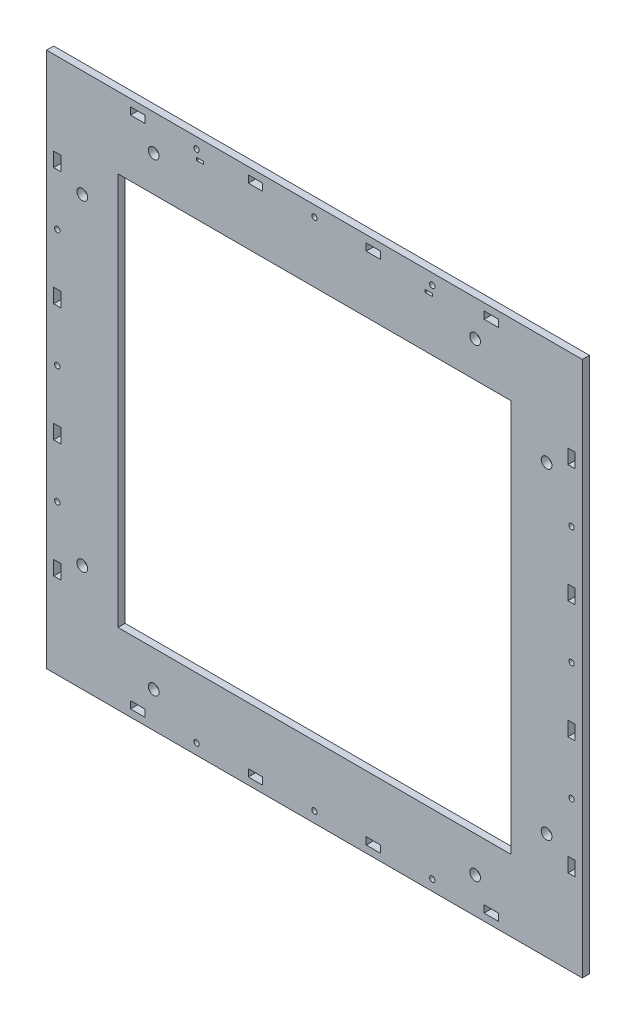
from build123d import *

# Parameters (mm, degrees)
SKETCH_1_R          = 21.5
SKETCH_1_R_2        = 2.1
SKETCH_1_W          = 4
SKETCH_1_H          = 1.5
EXTRUDE_1_DEPTH     = 4
SKETCH_3_R          = 1.5
SKETCH_3_R_2        = 1.65
SKETCH_3_W          = 8.03
SKETCH_3_H          = 4.03
SKETCH_3_W_2        = 4.03
SKETCH_3_H_2        = 8.03
CUT_EXTRUDE_2_DEPTH = 4
SKETCH_7_R          = 3
CUT_EXTRUDE_3_DEPTH = 10
SKETCH_8_W          = 220
SKETCH_8_H          = 220
CUT_EXTRUDE_4_DEPTH = 4


with BuildPart() as part:
    # 草图1 → 凸台-拉伸1 (new body)
    with BuildSketch(Plane.XY):
        Polygon((151.457142857, -41.187142857), (151.457142857, 108.812857143), (-148.542857143, 108.812857143), (-148.542857143, -191.187142857), (151.457142857, -191.187142857), align=None)
        with Locations((1.457142857, -41.187142857)):
            Circle(SKETCH_1_R, mode=Mode.SUBTRACT)
        with Locations((25.027142857, -17.617142857)):
            Circle(SKETCH_1_R_2, mode=Mode.SUBTRACT)
        with Locations((25.027142857, -64.757142857)):
            Circle(SKETCH_1_R_2, mode=Mode.SUBTRACT)
        with Locations((-22.112857143, -64.757142857)):
            Circle(SKETCH_1_R_2, mode=Mode.SUBTRACT)
        with Locations((-22.112857143, -17.617142857)):
            Circle(SKETCH_1_R_2, mode=Mode.SUBTRACT)
        with Locations((65.457142857, 98.062857143)):
            Rectangle(SKETCH_1_W, SKETCH_1_H, mode=Mode.SUBTRACT)
        with Locations((-62.542857143, 98.062857143)):
            Rectangle(SKETCH_1_W, SKETCH_1_H, mode=Mode.SUBTRACT)
    extrude(amount=EXTRUDE_1_DEPTH)

    # 草图3 → 切除-拉伸2 (cut)
    with BuildSketch(Plane.XY.offset(4)):
        with Locations((1.457142857, -185.187142857)):
            Circle(SKETCH_3_R)
        with Locations((67.457142857, -185.187142857)):
            Circle(SKETCH_3_R)
        with Locations(Location((-64.542857143, -185.187142857, 0), (0, 0, 180))):
            Circle(SKETCH_3_R)
        with Locations(Location((-142.542857143, 24.812857143, 0), (0, 0, 180))):
            Circle(SKETCH_3_R)
        with Locations((-142.542857143, -41.187142857)):
            Circle(SKETCH_3_R)
        with Locations((-142.542857143, -107.187142857)):
            Circle(SKETCH_3_R)
        with Locations(Location((67.457142857, 102.812857143, 0), (0, 0, 180))):
            Circle(SKETCH_3_R)
        with Locations((1.457142857, 102.812857143)):
            Circle(SKETCH_3_R)
        with Locations((-64.542857143, 102.812857143)):
            Circle(SKETCH_3_R)
        with Locations(Location((145.457142857, -107.187142857, 0), (0, 0, 180))):
            Circle(SKETCH_3_R)
        with Locations((145.457142857, -41.187142857)):
            Circle(SKETCH_3_R)
        with Locations((145.457142857, 24.812857143)):
            Circle(SKETCH_3_R)
        with Locations((1.457142857, -108.687142857)):
            Circle(SKETCH_3_R_2)
        with Locations((-46.272564873, -88.916850587)):
            Circle(SKETCH_3_R_2)
        with Locations((-66.042857143, -41.187142857)):
            Circle(SKETCH_3_R_2)
        with Locations((-46.272564873, 6.542564873)):
            Circle(SKETCH_3_R_2)
        with Locations((1.457142857, 26.312857143)):
            Circle(SKETCH_3_R_2)
        with Locations((49.186850587, 6.542564873)):
            Circle(SKETCH_3_R_2)
        with Locations((68.957142857, -41.187142857)):
            Circle(SKETCH_3_R_2)
        with Locations((49.186850587, -88.916850587)):
            Circle(SKETCH_3_R_2)
        with Locations((1.457142857, -125.187142857)):
            Circle(SKETCH_3_R)
        with Locations((100.457142857, -185.187142857)):
            Rectangle(SKETCH_3_W, SKETCH_3_H)
        with Locations((34.457142857, -185.187142857)):
            Rectangle(SKETCH_3_W, SKETCH_3_H)
        with Locations((-31.542857143, -185.187142857)):
            Rectangle(SKETCH_3_W, SKETCH_3_H)
        with Locations((-97.542857143, -185.187142857)):
            Rectangle(SKETCH_3_W, SKETCH_3_H)
        with Locations((-142.542857143, 57.812857143)):
            Rectangle(SKETCH_3_W_2, SKETCH_3_H_2)
        with Locations((-142.542857143, -8.187142857)):
            Rectangle(SKETCH_3_W_2, SKETCH_3_H_2)
        with Locations((-142.542857143, -74.187142857)):
            Rectangle(SKETCH_3_W_2, SKETCH_3_H_2)
        with Locations((-142.542857143, -140.187142857)):
            Rectangle(SKETCH_3_W_2, SKETCH_3_H_2)
        with Locations((100.457142857, 102.812857143)):
            Rectangle(SKETCH_3_W, SKETCH_3_H)
        with Locations((34.457142857, 102.812857143)):
            Rectangle(SKETCH_3_W, SKETCH_3_H)
        with Locations((-31.542857143, 102.812857143)):
            Rectangle(SKETCH_3_W, SKETCH_3_H)
        with Locations((-97.542857143, 102.812857143)):
            Rectangle(SKETCH_3_W, SKETCH_3_H)
        with Locations((145.457142857, -140.187142857)):
            Rectangle(SKETCH_3_W_2, SKETCH_3_H_2)
        with Locations((145.457142857, -74.187142857)):
            Rectangle(SKETCH_3_W_2, SKETCH_3_H_2)
        with Locations((145.457142857, -8.187142857)):
            Rectangle(SKETCH_3_W_2, SKETCH_3_H_2)
        with Locations((145.457142857, 57.812857143)):
            Rectangle(SKETCH_3_W_2, SKETCH_3_H_2)
    extrude(amount=-CUT_EXTRUDE_2_DEPTH, mode=Mode.SUBTRACT)

    # 草图7 → 切除-拉伸3 (cut)
    with BuildSketch(Plane.XY.offset(4)):
        with Locations((-88.542857143, -171.187142857)):
            Circle(SKETCH_7_R)
        with Locations((91.457142857, -171.187142857)):
            Circle(SKETCH_7_R)
        with Locations((-128.542857143, 48.812857143)):
            Circle(SKETCH_7_R)
        with Locations((-128.542857143, -131.187142857)):
            Circle(SKETCH_7_R)
        with Locations((91.457142857, 88.812857143)):
            Circle(SKETCH_7_R)
        with Locations((-88.542857143, 88.812857143)):
            Circle(SKETCH_7_R)
        with Locations((131.457142857, -131.187142857)):
            Circle(SKETCH_7_R)
        with Locations((131.457142857, 48.812857143)):
            Circle(SKETCH_7_R)
    extrude(amount=-CUT_EXTRUDE_3_DEPTH, mode=Mode.SUBTRACT)

    # 草图8 → 切除-拉伸4 (cut)
    with BuildSketch(Plane.XY.offset(4)):
        with Locations((1.457142857, -41.187142857)):
            Rectangle(SKETCH_8_W, SKETCH_8_H)
    extrude(amount=-CUT_EXTRUDE_4_DEPTH, mode=Mode.SUBTRACT)


solid = part.part
